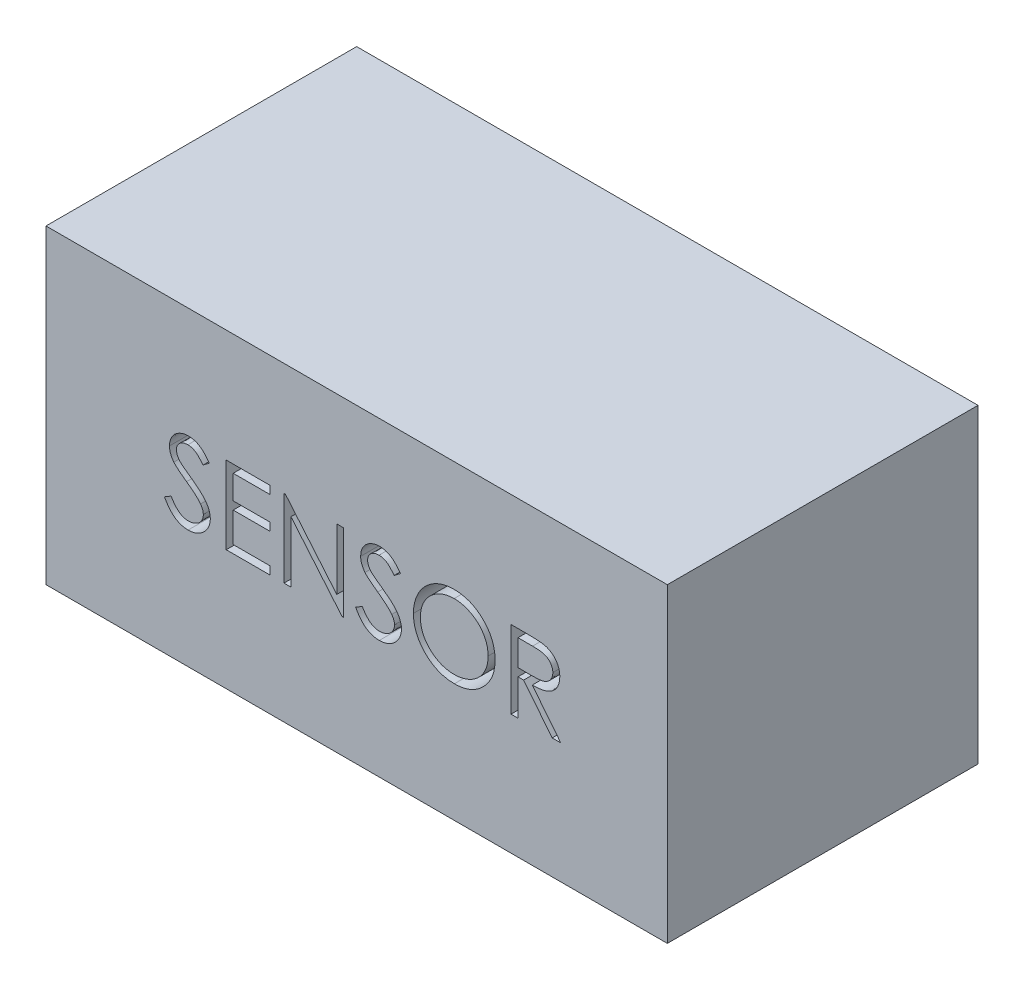
from build123d import *

# Parameters (mm, degrees)
SKETCH1_W           = 76.2
SKETCH1_H           = 76.2
BOSS_EXTRUDE1_DEPTH = 152.4
CUT_EXTRUDE1_DEPTH  = 10


with BuildPart() as part:
    # Sketch1 → Boss-Extrude1 (new body)
    with BuildSketch(Plane(origin=(0, 0, 0), x_dir=(0, 0, -1), z_dir=(1, 0, 0))):
        with Locations((-4.037086093, -17.536092715)):
            Rectangle(SKETCH1_W, SKETCH1_H)
    extrude(amount=BOSS_EXTRUDE1_DEPTH)

    # Sketch2 → Cut-Extrude1 (cut)
    # profile 1 of 6: a face of its own
    with BuildSketch(Plane.XY.offset(42.137086093)):
        with BuildLine():
            Line((29.064914894, -22.43625599), (30.675311528, -21.470781231))
            add(Edge.make_bspline(
                [(30.675311528, -21.470781231), (30.825089363, -21.721503097), (31.112057913, -22.201876518), (31.590764596, -22.850980996), (32.086788013, -23.402680735), (32.603801385, -23.85376627), (33.138648903, -24.208906639), (33.69482211, -24.460378786), (34.270446765, -24.617220023), (34.662189994, -24.636270495), (34.857763451, -24.645781231)],
                knots=[0, 0, 0, 0, 1.272034388, 2.437168799, 3.508375237, 4.49857839, 5.41946034, 6.295179144, 7.148887113, 8, 8, 8, 8], degree=3))
            add(Edge.make_bspline(
                [(34.857763451, -24.645781231), (35.024787649, -24.64112937), (35.355913514, -24.631907046), (35.843388008, -24.543292967), (36.316817532, -24.407155522), (36.766444546, -24.212187309), (37.186064962, -23.976302123), (37.554038546, -23.691389356), (37.872152391, -23.372404151), (38.132370572, -23.016535702), (38.332014764, -22.633809508), (38.485460165, -22.240966115), (38.570614066, -21.831834337), (38.583441538, -21.556368817), (38.589914894, -21.41735575)],
                knots=[0, 0, 0, 0, 1.095163259, 2.171163733, 3.241058638, 4.321873601, 5.38011039, 6.391990106, 7.366004449, 8.327778327, 9.272591725, 10.192022065, 11.087607919, 12, 12, 12, 12], degree=3))
            add(Edge.make_bspline(
                [(38.589914894, -21.41735575), (38.581890431, -21.258746268), (38.565577872, -20.936316369), (38.427702244, -20.460612543), (38.210808486, -19.989845841), (38.010714669, -19.698646095), (37.906831961, -19.547463923)],
                knots=[0, 0, 0, 0, 0.938893495, 1.908633276, 2.914225137, 4, 4, 4, 4], degree=3))
            add(Edge.make_bspline(
                [(37.906831961, -19.547463923), (37.821539047, -19.438351926), (37.642477242, -19.209284937), (37.334642781, -18.868315869), (36.973421501, -18.516607046), (36.57117501, -18.140728465), (36.113250626, -17.758162029), (35.613990869, -17.350664687), (35.060649008, -16.933733246), (34.672576034, -16.654119711), (34.472336769, -16.509843731)],
                knots=[0, 0, 0, 0, 0.722233717, 1.516239348, 2.393582979, 3.351407094, 4.387010283, 5.505090956, 6.712668013, 8, 8, 8, 8], degree=3))
            add(Edge.make_bspline(
                [(34.472336769, -16.509843731), (34.271909018, -16.367085275), (33.888706421, -16.094141979), (33.352810423, -15.689061234), (32.873596989, -15.318708172), (32.453196056, -14.979596335), (32.091792536, -14.671679729), (31.786538542, -14.397915232), (31.54521011, -14.150898993), (31.411013306, -13.990653976), (31.35076225, -13.918707914)],
                knots=[0, 0, 0, 0, 1.452282411, 2.77665338, 3.964542531, 5.026858415, 5.96415736, 6.766646006, 7.446254459, 8, 8, 8, 8], degree=3))
            add(Edge.make_bspline(
                [(31.35076225, -13.918707914), (31.266547396, -13.806579413), (31.100927585, -13.586063668), (30.882309755, -13.241395514), (30.696495169, -12.888571741), (30.550831618, -12.526644249), (30.428170199, -12.160694136), (30.345667747, -11.785946642), (30.29400743, -11.404083304), (30.288717046, -11.147106965), (30.28606874, -11.018467529)],
                knots=[0, 0, 0, 0, 1.068054152, 2.10047183, 3.106115577, 4.101338837, 5.06977816, 6.043150881, 7.020423561, 8, 8, 8, 8], degree=3))
            add(Edge.make_bspline(
                [(30.28606874, -11.018467529), (30.293172806, -10.816919756), (30.307229094, -10.418132152), (30.426103909, -9.835578632), (30.613734945, -9.279392561), (30.87659712, -8.755080316), (31.215454998, -8.276294049), (31.607590944, -7.837526355), (32.074650605, -7.468671643), (32.587109883, -7.146388868), (33.148030994, -6.894134618), (33.735810054, -6.703846998), (34.35138126, -6.596028038), (34.768321179, -6.580555275), (34.979878836, -6.572704308)],
                knots=[0, 0, 0, 0, 1.005424448, 1.989358655, 2.955360095, 3.929531133, 4.905563448, 5.876582895, 6.856512386, 7.866279853, 8.892233794, 9.918561126, 10.94386622, 12, 12, 12, 12], degree=3))
            add(Edge.make_bspline(
                [(34.979878836, -6.572704308), (35.204364582, -6.580447053), (35.650795082, -6.595844902), (36.307471527, -6.729725751), (36.939717712, -6.951253693), (37.448316053, -7.20265196), (37.846367226, -7.453738665), (38.149930243, -7.682446566), (38.457546654, -7.945745372), (38.771697781, -8.244336411), (39.087060513, -8.580959442), (39.408316731, -8.953309049), (39.73621768, -9.359109731), (39.94716029, -9.648803085), (40.055299509, -9.797313683)],
                knots=[0, 0, 0, 0, 1.286793592, 2.559021753, 3.825965368, 5.121522368, 5.803751409, 6.523245864, 7.299691795, 8.125521123, 9.008227632, 9.944561021, 10.946284179, 12, 12, 12, 12], degree=3))
            Line((40.055299509, -9.797313683), (38.509776673, -10.968858154))
            add(Edge.make_bspline(
                [(38.509776673, -10.968858154), (38.416453812, -10.848632567), (38.236735801, -10.617106198), (37.963888165, -10.292868037), (37.706720524, -9.996686913), (37.453353349, -9.739429573), (37.217168012, -9.507007962), (36.987930967, -9.308018428), (36.768941141, -9.140511259), (36.492896242, -8.961748454), (36.146089804, -8.784548056), (35.710745399, -8.634602359), (35.255797245, -8.544495522), (34.945937394, -8.53258172), (34.789073548, -8.526550462)],
                knots=[0, 0, 0, 0, 1.181633172, 2.275549214, 3.290209073, 4.226197932, 5.078386478, 5.862611352, 6.581680152, 7.217281963, 8.414376989, 9.595101626, 10.782541182, 12, 12, 12, 12], degree=3))
            add(Edge.make_bspline(
                [(34.789073548, -8.526550462), (34.592278761, -8.533145571), (34.212778555, -8.545863619), (33.673988841, -8.684765253), (33.189063335, -8.903469379), (32.772398659, -9.20998376), (32.425487398, -9.573136591), (32.174541973, -9.991032931), (32.023501791, -10.452491437), (32.005070755, -10.774391023), (31.995684125, -10.938329308)],
                knots=[0, 0, 0, 0, 1.14458467, 2.207223713, 3.21896685, 4.227309161, 5.202851033, 6.127160689, 7.046193047, 8, 8, 8, 8], degree=3))
            add(Edge.make_bspline(
                [(31.995684125, -10.938329308), (31.997823857, -11.040390927), (32.00210682, -11.244681055), (32.061841076, -11.546495223), (32.138581709, -11.847546942), (32.260189462, -12.146482714), (32.428076043, -12.448530583), (32.648539929, -12.758891755), (32.926198099, -13.080301769), (33.138888695, -13.289347618), (33.251182923, -13.399717529)],
                knots=[0, 0, 0, 0, 0.858281714, 1.717966888, 2.583508476, 3.4729293, 4.427298488, 5.488583878, 6.674047936, 8, 8, 8, 8], degree=3))
            add(Edge.make_bspline(
                [(33.251182923, -13.399717529), (33.292882678, -13.436930484), (33.391951752, -13.525339946), (33.573067862, -13.670077931), (33.812242235, -13.848618734), (34.103229359, -14.0695297), (34.451394571, -14.325787372), (34.856776155, -14.614115175), (35.314855355, -14.943873174), (35.639913212, -15.174419216), (35.811789894, -15.296322096)],
                knots=[0, 0, 0, 0, 0.420754252, 0.999615792, 1.744751191, 2.668019286, 3.750313428, 4.999500688, 6.413464383, 8, 8, 8, 8], degree=3))
            add(Edge.make_bspline(
                [(35.811789894, -15.296322096), (36.018541793, -15.446770067), (36.418888192, -15.738091712), (36.988524448, -16.175782771), (37.505017889, -16.60385134), (37.970181897, -17.019563744), (38.388611927, -17.41976665), (38.755665807, -17.809274817), (39.075083582, -18.18529772), (39.418959042, -18.667385596), (39.770338031, -19.259465498), (40.072098236, -19.984879911), (40.262371527, -20.713114169), (40.287253632, -21.202573093), (40.299530278, -21.44406849)],
                knots=[0, 0, 0, 0, 1.163667725, 2.253281268, 3.268753668, 4.215851969, 5.092017293, 5.902905408, 6.650798638, 7.335211899, 8.59617414, 9.77448103, 10.901945474, 12, 12, 12, 12], degree=3))
            add(Edge.make_bspline(
                [(40.299530278, -21.44406849), (40.295953569, -21.614856449), (40.288869609, -21.953115779), (40.207439492, -22.449804126), (40.088133886, -22.932209289), (39.908316942, -23.394368343), (39.688843752, -23.844736266), (39.410353174, -24.271499267), (39.087549918, -24.684102665), (38.717251855, -25.071544239), (38.312053444, -25.427214249), (37.883789334, -25.743602426), (37.431758563, -26.007408587), (36.958413325, -26.22267817), (36.463644893, -26.391044886), (35.947619669, -26.513034931), (35.409487044, -26.587905301), (35.043724423, -26.595676402), (34.857763451, -26.599627385)],
                knots=[0, 0, 0, 0, 0.983748083, 1.948392443, 2.894712957, 3.844097841, 4.80183111, 5.778335162, 6.776009319, 7.81870978, 8.863265674, 9.881300176, 10.883814829, 11.87499822, 12.874611388, 13.892143829, 14.928324115, 16, 16, 16, 16], degree=3))
            add(Edge.make_bspline(
                [(34.857763451, -26.599627385), (34.713879656, -26.596845096), (34.427924134, -26.591315559), (34.004962525, -26.542431733), (33.590545618, -26.473268784), (33.189873597, -26.363464203), (32.797784257, -26.230239513), (32.41598288, -26.066200875), (32.04428443, -25.869620107), (31.680605872, -25.644857187), (31.32587215, -25.383285749), (30.983410475, -25.078630004), (30.641984479, -24.739292327), (30.311671651, -24.356057689), (29.98579068, -23.935117552), (29.670766765, -23.472533568), (29.36007913, -22.9708254), (29.165140655, -22.617774005), (29.064914894, -22.43625599)],
                knots=[0, 0, 0, 0, 0.915332311, 1.819136955, 2.706846663, 3.586547465, 4.459518054, 5.340707479, 6.227863349, 7.133153174, 8.059268498, 9.028702269, 10.047606654, 11.120612155, 12.245963614, 13.433783089, 14.680604001, 16, 16, 16, 16], degree=3))
        make_face()
    # profile 2 of 6: a face of its own
    with BuildSketch(Plane.XY.offset(42.137086093)):
        Polygon((44.207222586, -7.061165846), (54.953376432, -7.061165846), (54.953376432, -9.015012), (45.916837971, -9.015012), (45.916837971, -14.876550462), (54.953376432, -14.876550462), (54.953376432, -16.830396615), (45.916837971, -16.830396615), (45.916837971, -24.157319692), (54.953376432, -24.157319692), (54.953376432, -26.111165846), (44.207222586, -26.111165846), align=None)
    # profile 3 of 6: a face of its own
    with BuildSketch(Plane.XY.offset(42.137086093)):
        Polygon((58.372607201, -26.111165846), (58.372607201, -7.061165846), (58.731321144, -7.061165846), (71.316837971, -22.054645414), (71.316837971, -7.061165846), (73.026453355, -7.061165846), (73.026453355, -26.111165846), (72.637210567, -26.111165846), (60.082222586, -11.152031231), (60.082222586, -26.111165846), align=None)
    # profile 4 of 6: a face of its own
    with BuildSketch(Plane.XY.offset(42.137086093)):
        with BuildLine():
            Line((75.957222586, -22.43625599), (77.567619221, -21.470781231))
            add(Edge.make_bspline(
                [(77.567619221, -21.470781231), (77.717397055, -21.721503097), (78.004365605, -22.201876518), (78.483072289, -22.850980996), (78.979095705, -23.402680735), (79.496109078, -23.85376627), (80.030956595, -24.208906639), (80.587129802, -24.460378786), (81.162754457, -24.617220023), (81.554497686, -24.636270495), (81.750071144, -24.645781231)],
                knots=[0, 0, 0, 0, 1.272034388, 2.437168799, 3.508375237, 4.49857839, 5.41946034, 6.295179144, 7.148887113, 8, 8, 8, 8], degree=3))
            add(Edge.make_bspline(
                [(81.750071144, -24.645781231), (81.917095342, -24.64112937), (82.248221206, -24.631907046), (82.7356957, -24.543292967), (83.209125224, -24.407155522), (83.658752238, -24.212187309), (84.078372654, -23.976302123), (84.446346239, -23.691389356), (84.764460083, -23.372404151), (85.024678264, -23.016535702), (85.224322456, -22.633809508), (85.377767857, -22.240966115), (85.462921758, -21.831834337), (85.47574923, -21.556368817), (85.482222586, -21.41735575)],
                knots=[0, 0, 0, 0, 1.095163259, 2.171163733, 3.241058638, 4.321873601, 5.38011039, 6.391990106, 7.366004449, 8.327778327, 9.272591725, 10.192022065, 11.087607919, 12, 12, 12, 12], degree=3))
            add(Edge.make_bspline(
                [(85.482222586, -21.41735575), (85.474198124, -21.258746268), (85.457885564, -20.936316369), (85.320009937, -20.460612543), (85.103116179, -19.989845841), (84.903022361, -19.698646095), (84.799139653, -19.547463923)],
                knots=[0, 0, 0, 0, 0.938893495, 1.908633276, 2.914225137, 4, 4, 4, 4], degree=3))
            add(Edge.make_bspline(
                [(84.799139653, -19.547463923), (84.713846739, -19.438351926), (84.534784934, -19.209284937), (84.226950473, -18.868315869), (83.865729194, -18.516607046), (83.463482702, -18.140728465), (83.005558318, -17.758162029), (82.506298561, -17.350664687), (81.952956701, -16.933733246), (81.564883726, -16.654119711), (81.364644461, -16.509843731)],
                knots=[0, 0, 0, 0, 0.722233717, 1.516239348, 2.393582979, 3.351407094, 4.387010283, 5.505090956, 6.712668013, 8, 8, 8, 8], degree=3))
            add(Edge.make_bspline(
                [(81.364644461, -16.509843731), (81.16421671, -16.367085275), (80.781014114, -16.094141979), (80.245118115, -15.689061234), (79.765904681, -15.318708172), (79.345503748, -14.979596335), (78.984100228, -14.671679729), (78.678846234, -14.397915232), (78.437517802, -14.150898993), (78.303320999, -13.990653976), (78.243069942, -13.918707914)],
                knots=[0, 0, 0, 0, 1.452282411, 2.77665338, 3.964542531, 5.026858415, 5.96415736, 6.766646006, 7.446254459, 8, 8, 8, 8], degree=3))
            add(Edge.make_bspline(
                [(78.243069942, -13.918707914), (78.158855089, -13.806579413), (77.993235277, -13.586063668), (77.774617448, -13.241395514), (77.588802861, -12.888571741), (77.443139311, -12.526644249), (77.320477891, -12.160694136), (77.23797544, -11.785946642), (77.186315122, -11.404083304), (77.181024738, -11.147106965), (77.178376432, -11.018467529)],
                knots=[0, 0, 0, 0, 1.068054152, 2.10047183, 3.106115577, 4.101338837, 5.06977816, 6.043150881, 7.020423561, 8, 8, 8, 8], degree=3))
            add(Edge.make_bspline(
                [(77.178376432, -11.018467529), (77.185480498, -10.816919756), (77.199536786, -10.418132152), (77.318411602, -9.835578632), (77.506042637, -9.279392561), (77.768904812, -8.755080316), (78.10776269, -8.276294049), (78.499898637, -7.837526355), (78.966958297, -7.468671643), (79.479417575, -7.146388868), (80.040338686, -6.894134618), (80.628117746, -6.703846998), (81.243688953, -6.596028038), (81.660628871, -6.580555275), (81.872186528, -6.572704308)],
                knots=[0, 0, 0, 0, 1.005424448, 1.989358655, 2.955360095, 3.929531133, 4.905563448, 5.876582895, 6.856512386, 7.866279853, 8.892233794, 9.918561126, 10.94386622, 12, 12, 12, 12], degree=3))
            add(Edge.make_bspline(
                [(81.872186528, -6.572704308), (82.096672274, -6.580447053), (82.543102775, -6.595844902), (83.199779219, -6.729725751), (83.832025404, -6.951253693), (84.340623746, -7.20265196), (84.738674919, -7.453738665), (85.042237935, -7.682446566), (85.349854346, -7.945745372), (85.664005473, -8.244336411), (85.979368205, -8.580959442), (86.300624424, -8.953309049), (86.628525372, -9.359109731), (86.839467983, -9.648803085), (86.947607201, -9.797313683)],
                knots=[0, 0, 0, 0, 1.286793592, 2.559021753, 3.825965368, 5.121522368, 5.803751409, 6.523245864, 7.299691795, 8.125521123, 9.008227632, 9.944561021, 10.946284179, 12, 12, 12, 12], degree=3))
            Line((86.947607201, -9.797313683), (85.402084365, -10.968858154))
            add(Edge.make_bspline(
                [(85.402084365, -10.968858154), (85.308761504, -10.848632567), (85.129043493, -10.617106198), (84.856195858, -10.292868037), (84.599028217, -9.996686913), (84.345661041, -9.739429573), (84.109475704, -9.507007962), (83.88023866, -9.308018428), (83.661248834, -9.140511259), (83.385203934, -8.961748454), (83.038397496, -8.784548056), (82.603053092, -8.634602359), (82.148104937, -8.544495522), (81.838245086, -8.53258172), (81.68138124, -8.526550462)],
                knots=[0, 0, 0, 0, 1.181633172, 2.275549214, 3.290209073, 4.226197932, 5.078386478, 5.862611352, 6.581680152, 7.217281963, 8.414376989, 9.595101626, 10.782541182, 12, 12, 12, 12], degree=3))
            add(Edge.make_bspline(
                [(81.68138124, -8.526550462), (81.484586454, -8.533145571), (81.105086247, -8.545863619), (80.566296533, -8.684765253), (80.081371027, -8.903469379), (79.664706351, -9.20998376), (79.317795091, -9.573136591), (79.066849665, -9.991032931), (78.915809484, -10.452491437), (78.897378447, -10.774391023), (78.887991817, -10.938329308)],
                knots=[0, 0, 0, 0, 1.14458467, 2.207223713, 3.21896685, 4.227309161, 5.202851033, 6.127160689, 7.046193047, 8, 8, 8, 8], degree=3))
            add(Edge.make_bspline(
                [(78.887991817, -10.938329308), (78.890131549, -11.040390927), (78.894414512, -11.244681055), (78.954148768, -11.546495223), (79.030889401, -11.847546942), (79.152497154, -12.146482714), (79.320383735, -12.448530583), (79.540847621, -12.758891755), (79.818505791, -13.080301769), (80.031196387, -13.289347618), (80.143490615, -13.399717529)],
                knots=[0, 0, 0, 0, 0.858281714, 1.717966888, 2.583508476, 3.4729293, 4.427298488, 5.488583878, 6.674047936, 8, 8, 8, 8], degree=3))
            add(Edge.make_bspline(
                [(80.143490615, -13.399717529), (80.18519037, -13.436930484), (80.284259444, -13.525339946), (80.465375555, -13.670077931), (80.704549928, -13.848618734), (80.995537051, -14.0695297), (81.343702263, -14.325787372), (81.749083847, -14.614115175), (82.207163047, -14.943873174), (82.532220904, -15.174419216), (82.704097586, -15.296322096)],
                knots=[0, 0, 0, 0, 0.420754252, 0.999615792, 1.744751191, 2.668019286, 3.750313428, 4.999500688, 6.413464383, 8, 8, 8, 8], degree=3))
            add(Edge.make_bspline(
                [(82.704097586, -15.296322096), (82.910849486, -15.446770067), (83.311195884, -15.738091712), (83.88083214, -16.175782771), (84.397325582, -16.60385134), (84.86248959, -17.019563744), (85.28091962, -17.41976665), (85.647973499, -17.809274817), (85.967391274, -18.18529772), (86.311266734, -18.667385596), (86.662645723, -19.259465498), (86.964405928, -19.984879911), (87.154679219, -20.713114169), (87.179561325, -21.202573093), (87.191837971, -21.44406849)],
                knots=[0, 0, 0, 0, 1.163667725, 2.253281268, 3.268753668, 4.215851969, 5.092017293, 5.902905408, 6.650798638, 7.335211899, 8.59617414, 9.77448103, 10.901945474, 12, 12, 12, 12], degree=3))
            add(Edge.make_bspline(
                [(87.191837971, -21.44406849), (87.188261262, -21.614856449), (87.181177301, -21.953115779), (87.099747185, -22.449804126), (86.980441579, -22.932209289), (86.800624634, -23.394368343), (86.581151444, -23.844736266), (86.302660866, -24.271499267), (85.979857611, -24.684102665), (85.609559547, -25.071544239), (85.204361136, -25.427214249), (84.776097027, -25.743602426), (84.324066256, -26.007408587), (83.850721018, -26.22267817), (83.355952585, -26.391044886), (82.839927361, -26.513034931), (82.301794736, -26.587905301), (81.936032115, -26.595676402), (81.750071144, -26.599627385)],
                knots=[0, 0, 0, 0, 0.983748083, 1.948392443, 2.894712957, 3.844097841, 4.80183111, 5.778335162, 6.776009319, 7.81870978, 8.863265674, 9.881300176, 10.883814829, 11.87499822, 12.874611388, 13.892143829, 14.928324115, 16, 16, 16, 16], degree=3))
            add(Edge.make_bspline(
                [(81.750071144, -26.599627385), (81.606187348, -26.596845096), (81.320231826, -26.591315559), (80.897270217, -26.542431733), (80.48285331, -26.473268784), (80.08218129, -26.363464203), (79.690091949, -26.230239513), (79.308290573, -26.066200875), (78.936592122, -25.869620107), (78.572913564, -25.644857187), (78.218179842, -25.383285749), (77.875718167, -25.078630004), (77.534292172, -24.739292327), (77.203979343, -24.356057689), (76.878098372, -23.935117552), (76.563074457, -23.472533568), (76.252386822, -22.9708254), (76.057448347, -22.617774005), (75.957222586, -22.43625599)],
                knots=[0, 0, 0, 0, 0.915332311, 1.819136955, 2.706846663, 3.586547465, 4.459518054, 5.340707479, 6.227863349, 7.133153174, 8.059268498, 9.028702269, 10.047606654, 11.120612155, 12.245963614, 13.433783089, 14.680604001, 16, 16, 16, 16], degree=3))
        make_face()
    # profile 5 of 6: a face of its own
    with BuildSketch(Plane.XY.offset(42.137086093)):
        with BuildLine():
            add(Edge.make_bspline(
                [(100.013953355, -6.572704308), (100.366694617, -6.581638645), (101.059507559, -6.599186422), (102.077729502, -6.733511257), (103.049797092, -6.965896165), (103.983628848, -7.275393256), (104.868054906, -7.688257839), (105.709732307, -8.187287003), (106.506658434, -8.777708872), (107.248091954, -9.454959378), (107.926581926, -10.191832177), (108.524348535, -10.978204802), (109.025321591, -11.809322569), (109.436724233, -12.682687947), (109.759478094, -13.596325773), (109.982194603, -14.555106845), (110.124460821, -15.552818972), (110.141092981, -16.233322336), (110.149530278, -16.578533635)],
                knots=[0, 0, 0, 0, 1.065120563, 2.091984664, 3.0946048, 4.079830382, 5.057816894, 6.036188127, 7.030412546, 8.04752943, 9.064399622, 10.05169764, 11.02544977, 11.989514704, 12.962713494, 13.945757189, 14.957906945, 16, 16, 16, 16], degree=3))
            add(Edge.make_bspline(
                [(110.149530278, -16.578533635), (110.141094217, -16.921202021), (110.124465763, -17.59664111), (109.982032845, -18.588021856), (109.758652545, -19.541015504), (109.439721439, -20.454031128), (109.030279907, -21.328031868), (108.525971047, -22.160718003), (107.931931028, -22.952362515), (107.255890882, -23.694292879), (106.518922353, -24.374636255), (105.728454758, -24.967466136), (104.902265402, -25.477593157), (104.029722562, -25.884630011), (103.122398076, -26.209960035), (102.172171432, -26.431770778), (101.183495188, -26.574847399), (100.50928301, -26.591276751), (100.166597586, -26.599627385)],
                knots=[0, 0, 0, 0, 1.043624062, 2.057103931, 3.04512605, 4.022047818, 4.998200453, 5.980619268, 6.982898556, 8.009068085, 9.034988726, 10.034168286, 11.015286542, 11.987931943, 12.962482838, 13.94673481, 14.956375938, 16, 16, 16, 16], degree=3))
            add(Edge.make_bspline(
                [(100.166597586, -26.599627385), (99.821388078, -26.591194293), (99.140888246, -26.574570426), (98.141922382, -26.432068779), (97.182467805, -26.209231112), (96.265268265, -25.890772609), (95.389812291, -25.479198824), (94.554387698, -24.977343561), (93.762347768, -24.381856121), (93.020259119, -23.706035194), (92.341267055, -22.970315747), (91.74930531, -22.182003587), (91.247337193, -21.356564601), (90.83714534, -20.491708077), (90.512400212, -19.591614939), (90.290849702, -18.650281083), (90.147506877, -17.673073201), (90.130988641, -17.007722569), (90.122607201, -16.670120173)],
                knots=[0, 0, 0, 0, 1.053102029, 2.075944431, 3.073151272, 4.055350789, 5.033113405, 6.020478099, 7.024410459, 8.052272461, 9.079885166, 10.07527673, 11.055994387, 12.023226415, 12.992069828, 13.970394897, 14.97016774, 16, 16, 16, 16], degree=3))
            add(Edge.make_bspline(
                [(90.122607201, -16.670120173), (90.125517146, -16.443519503), (90.131300325, -15.99317683), (90.20092368, -15.324431478), (90.301952368, -14.666440898), (90.446742778, -14.021076167), (90.636108851, -13.389917093), (90.859549171, -12.768610798), (91.132453187, -12.163453673), (91.440957857, -11.571578927), (91.785282841, -11.002213039), (92.165606563, -10.464025594), (92.568570497, -9.952500454), (93.010331253, -9.480893191), (93.476329334, -9.035484289), (93.97412422, -8.623118644), (94.500678436, -8.240077839), (95.058257675, -7.894889983), (95.633122856, -7.582692407), (96.225723604, -7.314784904), (96.828011515, -7.084845626), (97.442807527, -6.898477706), (98.068479044, -6.751346196), (98.706391614, -6.6511576), (99.356037034, -6.581356669), (99.793704356, -6.575600837), (100.013953355, -6.572704308)],
                knots=[0, 0, 0, 0, 1.037015668, 2.060948919, 3.074880161, 4.083647147, 5.086022904, 6.090072063, 7.104153813, 8.122640571, 9.144368836, 10.147691507, 11.138137339, 12.123020368, 13.103399296, 14.087645067, 15.080126199, 16.082011238, 17.087798457, 18.072939717, 19.057185487, 20.037253025, 21.01195951, 21.997135196, 22.992090687, 24, 24, 24, 24], degree=3))
        make_face()
        with BuildLine():
            add(Edge.make_bspline(
                [(100.097907682, -8.526550462), (99.917125177, -8.528754221), (99.557288459, -8.533140673), (99.022339769, -8.590920496), (98.494426529, -8.67327032), (97.973439715, -8.790735455), (97.461559197, -8.950777514), (96.954013633, -9.134968742), (96.455431297, -9.35932925), (95.967458156, -9.612817826), (95.494391819, -9.893391238), (95.048008401, -10.203480427), (94.627152296, -10.535813416), (94.232853944, -10.891165788), (93.866271136, -11.271347192), (93.520188689, -11.670594022), (93.208478538, -12.100317887), (92.922807041, -12.548865958), (92.667167796, -13.015653993), (92.439844937, -13.495767672), (92.253895117, -13.993123367), (92.102244184, -14.502325282), (91.976515213, -15.022566955), (91.896864855, -15.557794933), (91.838450156, -16.105319757), (91.834314425, -16.475335276), (91.832222586, -16.662487962)],
                knots=[0, 0, 0, 0, 1.008559885, 2.007477868, 2.99961109, 3.989939068, 4.984837346, 5.991145699, 7.001802488, 8.033829008, 9.059044045, 10.069351652, 11.065060232, 12.050310815, 13.029377138, 14.011219647, 14.996725999, 15.989392538, 16.977580475, 17.965360261, 18.951710183, 19.937753436, 20.929683414, 21.935841486, 22.955955122, 24, 24, 24, 24], degree=3))
            add(Edge.make_bspline(
                [(91.832222586, -16.662487962), (91.839161478, -16.937690906), (91.852812424, -17.479100235), (91.972324341, -18.272495418), (92.156412516, -19.034975948), (92.427779039, -19.762369769), (92.767144528, -20.460929365), (93.186390888, -21.124457764), (93.683101053, -21.753134294), (94.24732682, -22.342569973), (94.864126123, -22.880573564), (95.519079981, -23.352814403), (96.205171759, -23.752375905), (96.92419062, -24.077886371), (97.672297939, -24.335821944), (98.454314324, -24.512598493), (99.265030397, -24.628942043), (99.817647249, -24.6401149), (100.097907682, -24.645781231)],
                knots=[0, 0, 0, 0, 1.032063989, 2.030389145, 3.003944642, 3.970395727, 4.937377036, 5.913328081, 6.909231446, 7.93887556, 8.970685674, 9.976071282, 10.964166581, 11.944589148, 12.933237628, 13.927779006, 14.949070134, 16, 16, 16, 16], degree=3))
            add(Edge.make_bspline(
                [(100.097907682, -24.645781231), (100.286282255, -24.643193128), (100.65988561, -24.638060144), (101.215576954, -24.586360203), (101.761257192, -24.503455314), (102.296160944, -24.384089888), (102.819681131, -24.234698665), (103.334002845, -24.05721946), (103.833647826, -23.83579748), (104.324919228, -23.5911522), (104.79516163, -23.312259343), (105.24406417, -23.012694557), (105.660312003, -22.680851064), (106.054315377, -22.330778399), (106.422403227, -21.955418027), (106.762086413, -21.555257962), (107.072221132, -21.127772385), (107.357784152, -20.679904677), (107.612527625, -20.211839359), (107.834482435, -19.729984969), (108.022784151, -19.235528016), (108.174795013, -18.72775532), (108.293914455, -18.207631272), (108.375992305, -17.674459446), (108.433405949, -17.129306453), (108.437733441, -16.760586323), (108.439914894, -16.574717529)],
                knots=[0, 0, 0, 0, 1.047197238, 2.076906641, 3.100256066, 4.114471768, 5.12198147, 6.126382909, 7.136867548, 8.15857795, 9.17633901, 10.174870724, 11.156907918, 12.133735059, 13.104061851, 14.077631395, 15.04955518, 16.038496417, 17.029181396, 18.010275684, 18.986308667, 19.968651475, 20.955262928, 21.950658345, 22.966943676, 24, 24, 24, 24], degree=3))
            add(Edge.make_bspline(
                [(108.439914894, -16.574717529), (108.437731693, -16.390120284), (108.433400913, -16.023937645), (108.376019729, -15.48258662), (108.29382774, -14.953251283), (108.175376429, -14.438009727), (108.02270345, -13.936730612), (107.834449551, -13.449884742), (107.612460993, -12.975658423), (107.357690514, -12.515223749), (107.071310104, -12.073401247), (106.758377151, -11.651022402), (106.413488613, -11.256019338), (106.046498392, -10.878640504), (105.648239716, -10.526934562), (105.22051663, -10.200784842), (104.768521755, -9.892320306), (104.289946374, -9.614051177), (103.796039997, -9.357070853), (103.289234026, -9.136901822), (102.775269926, -8.949819286), (102.255454686, -8.790251233), (101.725413047, -8.673730384), (101.188726493, -8.590846284), (100.646137543, -8.533160783), (100.281230875, -8.528760894), (100.097907682, -8.526550462)],
                knots=[0, 0, 0, 0, 1.02996197, 2.043119294, 3.035359645, 4.018872909, 4.991431989, 5.957985074, 6.929999688, 7.912076566, 8.892894881, 9.867085534, 10.843653904, 11.817741046, 12.803660682, 13.806313499, 14.818574707, 15.856120519, 16.894564902, 17.924820532, 18.937903209, 19.946497019, 20.957711757, 21.963978472, 22.977135795, 24, 24, 24, 24], degree=3))
        make_face(mode=Mode.SUBTRACT)
    # profile 6 of 6: a face of its own
    with BuildSketch(Plane.XY.offset(42.137086093)):
        with BuildLine():
            Line((114.057222586, -7.061165846), (117.86951225, -7.061165846))
            add(Edge.make_bspline(
                [(117.86951225, -7.061165846), (118.123917535, -7.062012679), (118.612403864, -7.06363869), (119.312209807, -7.0727052), (119.948083006, -7.098691336), (120.519690988, -7.121053769), (121.027023268, -7.161831335), (121.471635522, -7.200805715), (121.851479989, -7.251825211), (122.081418123, -7.299207585), (122.185527875, -7.320661039)],
                knots=[0, 0, 0, 0, 1.410062039, 2.707475311, 3.878576406, 4.937260626, 5.877586885, 6.699081471, 7.410979367, 8, 8, 8, 8], degree=3))
            add(Edge.make_bspline(
                [(122.185527875, -7.320661039), (122.324901072, -7.355096719), (122.600674257, -7.423233472), (122.997731045, -7.567249299), (123.37608758, -7.733907542), (123.734172195, -7.929652934), (124.070191287, -8.155938521), (124.387609522, -8.408857873), (124.687867258, -8.687027093), (124.958821559, -8.997459587), (125.214304112, -9.323141161), (125.429779351, -9.675314466), (125.615524905, -10.043586495), (125.763410147, -10.431702583), (125.882488831, -10.835898798), (125.966451649, -11.259836392), (126.016804541, -11.701583985), (126.021930926, -12.002889174), (126.024530278, -12.155667048)],
                knots=[0, 0, 0, 0, 1.027469482, 2.033020251, 3.019912614, 3.986113645, 4.951240523, 5.91722682, 6.890402269, 7.87763091, 8.8651537, 9.85103654, 10.82876324, 11.815024772, 12.821070561, 13.842952187, 14.906261191, 16, 16, 16, 16], degree=3))
            add(Edge.make_bspline(
                [(126.024530278, -12.155667048), (126.016534732, -12.40949526), (126.000933349, -12.904779846), (125.855472427, -13.623568357), (125.617203084, -14.294070198), (125.28887204, -14.915441128), (124.870754608, -15.475569069), (124.368243959, -15.967551404), (123.781059759, -16.379248643), (123.23443734, -16.664741765), (122.751578624, -16.847583168), (122.354068736, -16.976232493), (121.920452758, -17.075629761), (121.454885266, -17.164675621), (120.955428798, -17.231904129), (120.423280441, -17.28114345), (119.858060673, -17.31191763), (119.469772309, -17.316500542), (119.270023067, -17.318858154)],
                knots=[0, 0, 0, 0, 1.260483769, 2.459530307, 3.627416485, 4.787058657, 5.939039949, 7.08810263, 8.267026773, 9.491475466, 10.141966685, 10.831826277, 11.566392101, 12.351337768, 13.187381173, 14.07005841, 15.007169909, 16, 16, 16, 16], degree=3))
            Line((119.270023067, -17.318858154), (126.268761048, -26.111165846))
            Line((126.268761048, -26.111165846), (124.154638451, -26.111165846))
            Line((124.154638451, -26.111165846), (117.155900471, -17.318858154))
            Line((117.155900471, -17.318858154), (115.766837971, -17.318858154))
            Line((115.766837971, -17.318858154), (115.766837971, -26.111165846))
            Line((115.766837971, -26.111165846), (114.057222586, -26.111165846))
            Line((114.057222586, -26.111165846), (114.057222586, -7.061165846))
        make_face()
        with BuildLine():
            Line((115.766837971, -9.015012), (115.766837971, -15.365012))
            Line((115.766837971, -15.365012), (119.254758644, -15.39172474))
            add(Edge.make_bspline(
                [(119.254758644, -15.39172474), (119.417609141, -15.391796786), (119.733259788, -15.39193643), (120.189919121, -15.370198876), (120.615115729, -15.345470244), (121.007223251, -15.307645949), (121.366416854, -15.25889933), (121.692517003, -15.197923087), (121.986056014, -15.126882575), (122.328403773, -15.016928012), (122.71069118, -14.842723826), (123.126152411, -14.589274469), (123.47995085, -14.270491121), (123.778860929, -13.905964167), (124.01905112, -13.505172584), (124.188389587, -13.072920632), (124.29584488, -12.620120648), (124.30851882, -12.308908376), (124.314914894, -12.151850942)],
                knots=[0, 0, 0, 0, 1.146690395, 2.22261258, 3.21895312, 4.145990853, 4.996080663, 5.770904154, 6.481378293, 7.121626537, 8.300444488, 9.431385265, 10.535395872, 11.636531494, 12.74115979, 13.810798291, 14.895190096, 16, 16, 16, 16], degree=3))
            add(Edge.make_bspline(
                [(124.314914894, -12.151850942), (124.30837192, -11.998653162), (124.295406135, -11.695071063), (124.189549266, -11.250629609), (124.010537062, -10.831165209), (123.769297452, -10.438384226), (123.475387766, -10.081845864), (123.130757957, -9.776789217), (122.744831109, -9.525059987), (122.384126444, -9.364199716), (122.061723087, -9.265575944), (121.781798795, -9.196173181), (121.465506323, -9.140414), (121.111309899, -9.095738697), (120.720721594, -9.057339643), (120.291766479, -9.031476391), (119.827290575, -9.016160931), (119.505362278, -9.01540389), (119.338712971, -9.015012)],
                knots=[0, 0, 0, 0, 1.101028733, 2.181837193, 3.264309656, 4.369019818, 5.486613113, 6.575447106, 7.666700264, 8.788928104, 9.402425223, 10.0903467, 10.862060571, 11.710948788, 12.657782767, 13.684531032, 14.801375019, 16, 16, 16, 16], degree=3))
            Line((119.338712971, -9.015012), (115.766837971, -9.015012))
        make_face(mode=Mode.SUBTRACT)
    extrude(amount=-CUT_EXTRUDE1_DEPTH, mode=Mode.SUBTRACT)


solid = part.part
